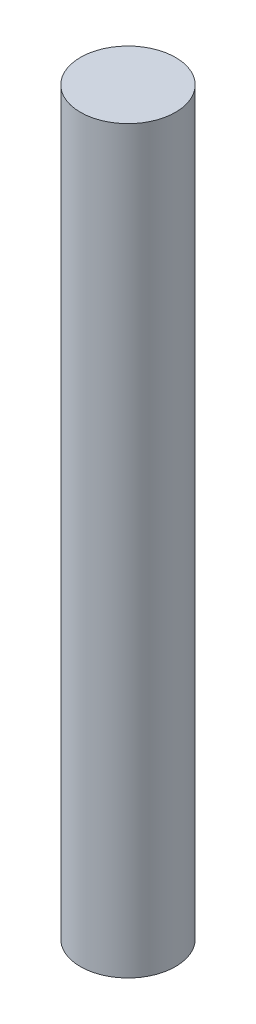
from build123d import *

# Parameters (mm, degrees)
SKETCH1_R           = 2.25
BOSS_EXTRUDE1_DEPTH = 35


with BuildPart() as part:
    # Sketch1 → Boss-Extrude1 (new body)
    with BuildSketch(Plane(origin=(0, 0, 0), x_dir=(1, 0, 0), z_dir=(0, 1, 0))):
        with Locations(Location((0, 0, 0), (0, 0, 270))):
            Circle(SKETCH1_R)
    extrude(amount=BOSS_EXTRUDE1_DEPTH)


solid = part.part
